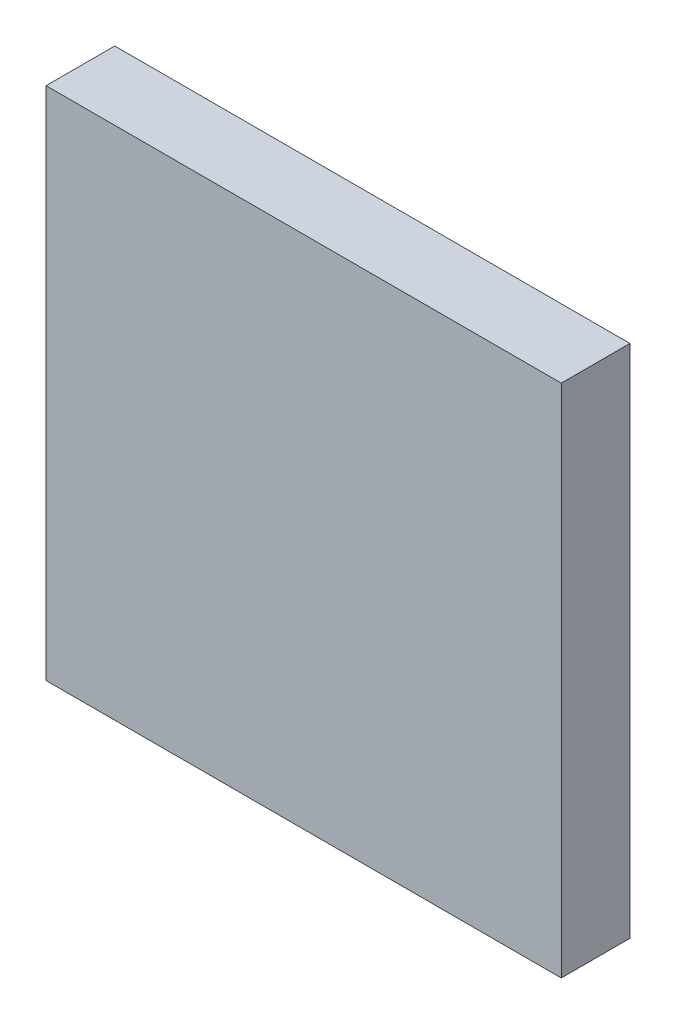
from build123d import *

# Parameters (mm, degrees)
SKETCH_1_W      = 30
SKETCH_1_H      = 30
EXTRUDE_1_DEPTH = 4
SKETCH_2_W      = 20
SKETCH_2_H      = 1
EXTRUDE_2_DEPTH = 2


with BuildPart() as part:
    # 草图1 → 凸台-拉伸1 (new body)
    with BuildSketch(Plane.XY):
        with Locations((-65.643548009, 36.54618509)):
            Rectangle(SKETCH_1_W, SKETCH_1_H)
    extrude(amount=EXTRUDE_1_DEPTH)

    # 草图2 → 凸台-拉伸2 (add)
    with BuildSketch(Plane(origin=(0, 0, 0), x_dir=(-1, 0, 0), z_dir=(0, 0, -1))):
        with Locations((65.643548009, 36.04618509)):
            Rectangle(SKETCH_2_W, SKETCH_2_H)
        with Locations((65.643548009, 37.04618509)):
            Rectangle(SKETCH_2_W, SKETCH_2_H)
    extrude(amount=EXTRUDE_2_DEPTH)


solid = part.part
